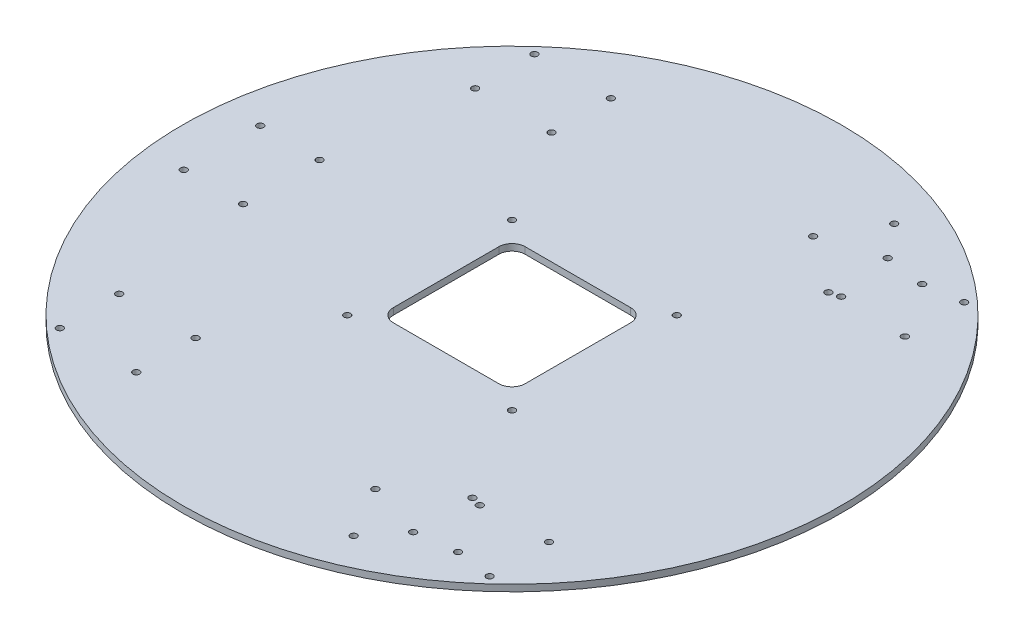
from build123d import *

# Parameters (mm, degrees)
SKETCH_1_R          = 250
EXTRUDE_1_DEPTH     = 5
SKETCH_2_R          = 2.5
CUT_EXTRUDE_1_DEPTH = 354.588744165
SKETCH_3_R          = 2.5
CUT_EXTRUDE_2_DEPTH = 354.588744165
CUT_EXTRUDE4_DEPTH  = 354.588744165


with BuildPart() as part:
    # 草图1 → 凸台-拉伸1 (new body)
    with BuildSketch(Plane(origin=(0, 0, 0), x_dir=(1, 0, 0), z_dir=(0, 1, 0))):
        Circle(SKETCH_1_R)
    extrude(amount=EXTRUDE_1_DEPTH)

    # 草图2 → 切除-拉伸1 (cut, through all)
    with BuildSketch(Plane(origin=(0, 5, 0), x_dir=(1, 0, 0), z_dir=(0, 1, 0))):
        with Locations((-220, -29)):
            Circle(SKETCH_2_R)
        with Locations((-220, 29)):
            Circle(SKETCH_2_R)
        with Locations((-175, -29)):
            Circle(SKETCH_2_R)
        with Locations((-175, 29)):
            Circle(SKETCH_2_R)
        with Locations((84.88526329, 205.025588833)):
            Circle(SKETCH_2_R)
        with Locations((135.11473671, 176.025588833)):
            Circle(SKETCH_2_R)
        with Locations((62.38526329, 166.054445662)):
            Circle(SKETCH_2_R)
        with Locations((112.61473671, 137.054445662)):
            Circle(SKETCH_2_R)
        with Locations((135.11473671, -176.025588833)):
            Circle(SKETCH_2_R)
        with Locations((84.88526329, -205.025588833)):
            Circle(SKETCH_2_R)
        with Locations((112.61473671, -137.054445662)):
            Circle(SKETCH_2_R)
        with Locations((62.38526329, -166.054445662)):
            Circle(SKETCH_2_R)
    extrude(amount=-CUT_EXTRUDE_1_DEPTH, mode=Mode.SUBTRACT)

    # 草图3 → 切除-拉伸2 (cut, through all)
    with BuildSketch(Plane(origin=(0, 5, 0), x_dir=(1, 0, 0), z_dir=(0, 1, 0))):
        with Locations((163, 135)):
            Circle(SKETCH_3_R)
        with Locations((105, 135)):
            Circle(SKETCH_3_R)
        with Locations((105, 180)):
            Circle(SKETCH_3_R)
        with Locations((163, 180)):
            Circle(SKETCH_3_R)
        with Locations((-163, 180)):
            Circle(SKETCH_3_R)
        with Locations((-105, 180)):
            Circle(SKETCH_3_R)
        with Locations((-105, 135)):
            Circle(SKETCH_3_R)
        with Locations((-163, 135)):
            Circle(SKETCH_3_R)
        with Locations((-163, -135)):
            Circle(SKETCH_3_R)
        with Locations((-105, -135)):
            Circle(SKETCH_3_R)
        with Locations((-105, -180)):
            Circle(SKETCH_3_R)
        with Locations((-163, -180)):
            Circle(SKETCH_3_R)
        with Locations((163, -180)):
            Circle(SKETCH_3_R)
        with Locations((105, -180)):
            Circle(SKETCH_3_R)
        with Locations((105, -135)):
            Circle(SKETCH_3_R)
        with Locations((163, -135)):
            Circle(SKETCH_3_R)
        with Locations((-62.5, 62.5)):
            Circle(SKETCH_3_R)
        with Locations((62.5, 62.5)):
            Circle(SKETCH_3_R)
        with Locations((62.5, -62.5)):
            Circle(SKETCH_3_R)
        with Locations((-62.5, -62.5)):
            Circle(SKETCH_3_R)
    extrude(amount=-CUT_EXTRUDE_2_DEPTH, mode=Mode.SUBTRACT)

    # Sketch2 → Cut-Extrude4 (cut, through all)
    with BuildSketch(Plane.XZ):
        with BuildLine():
            Line((-50, 40), (-50, -40))
            ThreePointArc((-50, -40), (-47.071067812, -47.071067812), (-40, -50))
            Line((-40, -50), (40, -50))
            ThreePointArc((40, -50), (47.071067812, -47.071067812), (50, -40))
            Line((50, -40), (50, 40))
            ThreePointArc((50, 40), (47.071067812, 47.071067812), (40, 50))
            Line((40, 50), (-40, 50))
            ThreePointArc((-40, 50), (-47.071067812, 47.071067812), (-50, 40))
        make_face()
    extrude(amount=-CUT_EXTRUDE4_DEPTH, mode=Mode.SUBTRACT)


solid = part.part
